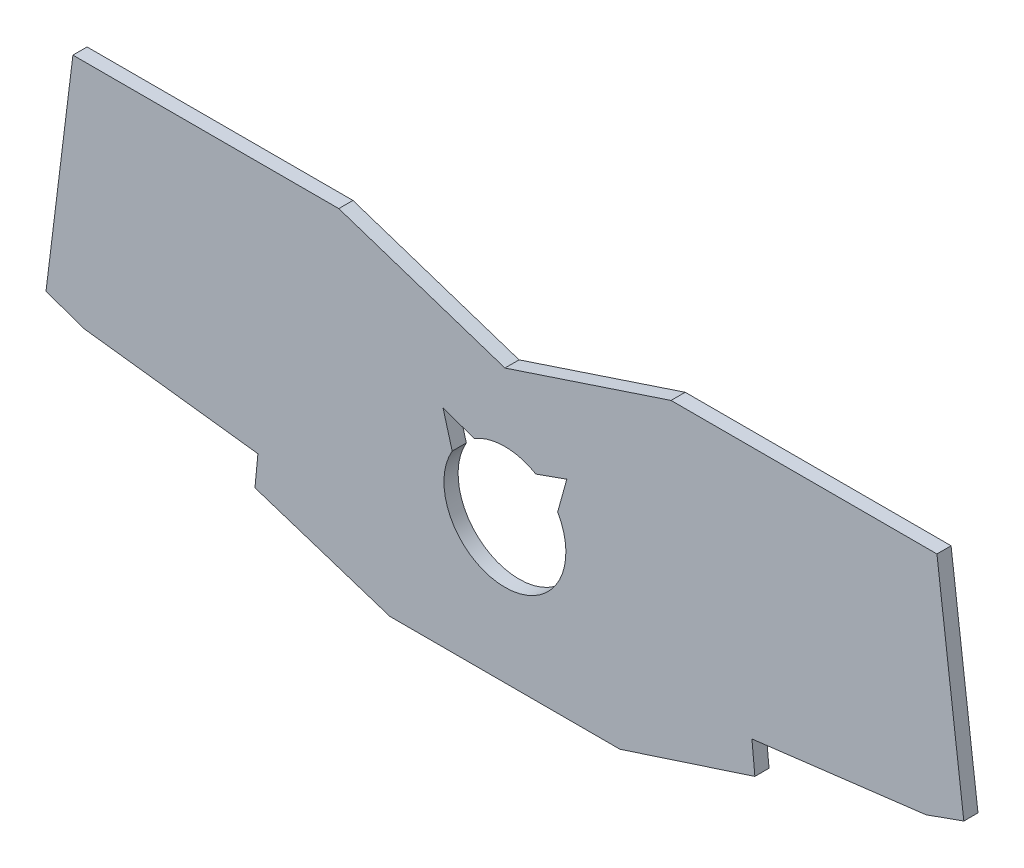
from build123d import *

# Parameters (mm, degrees)
EXTRUDE_2_DEPTH = 5


with BuildPart() as part:
    # Эскиз4 → Бобышка-Вытянуть2 (new body)
    with BuildSketch(Plane.XY):
        Polygon((162, -18.92), (152.5, 58), (58.64, 58), (0, 38.59), (-58.64, 58), (-152.5, 58), (-162, -18.92), (-148.658722082, -23.671565122), (-87.19, -31.21617284), (-88.237138959, -42.15617284), (-40.597138959, -57.662313559), (40.597138959, -57.662313559), (88.237138959, -42.15617284), (87.19, -31.21617284), (148.658722082, -23.671565122), align=None)
        with BuildLine():
            Line((10.908195141, 11.626317085), (21.848195141, 15.513282482))
            Line((21.848195141, 15.513282482), (18.617591482, 3.873282482))
            ThreePointArc((18.617591482, 3.873282482), (20.785443003, -1.336165522), (21.525, -6.93))
            ThreePointArc((21.525, -6.93), (-5.593834478, -27.715443003), (-18.617591482, 3.873282482))
            Line((-18.617591482, 3.873282482), (-21.848195141, 15.513282482))
            Line((-21.848195141, 15.513282482), (-10.908195141, 11.626317085))
            ThreePointArc((-10.908195141, 11.626317085), (0, 14.595), (10.908195141, 11.626317085))
        make_face(mode=Mode.SUBTRACT)
    extrude(amount=EXTRUDE_2_DEPTH)


solid = part.part
